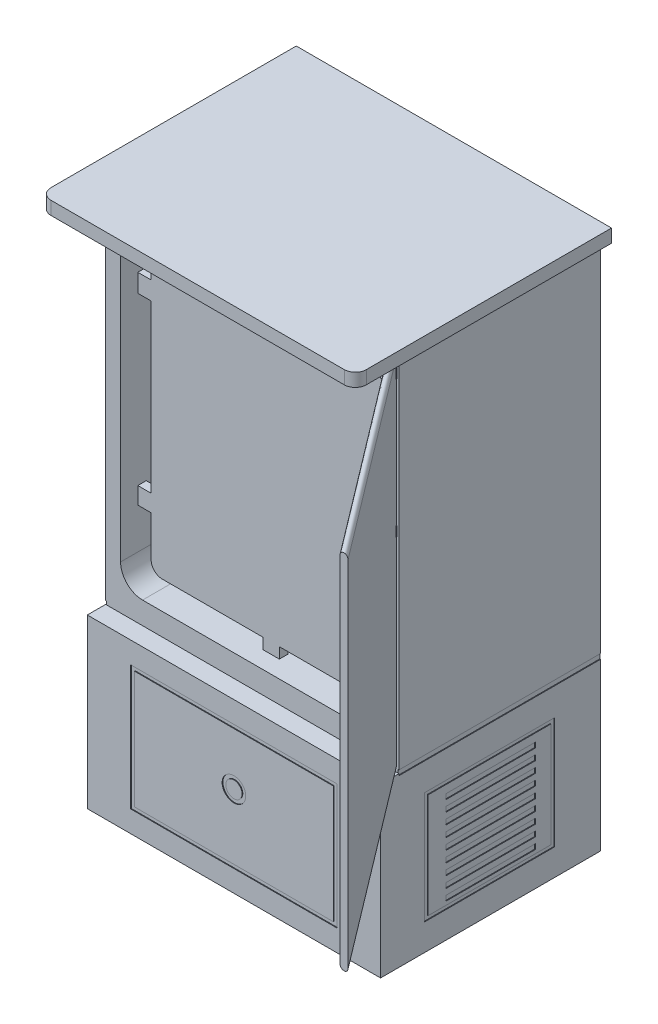
from build123d import *

# Parameters (mm, degrees)
CROQUIS1_W                = 800
CROQUIS1_H                = 600
SALIENTE_EXTRUIR1_DEPTH   = 1000
CORTAR_EXTRUIR1_DEPTH     = 567
CROQUIS3_W                = 800
CROQUIS3_H                = 35.957768847
SALIENTE_EXTRUIR2_DEPTH   = 99
CROQUIS4_W                = 699
CROQUIS4_H                = 35.957768847
SALIENTE_EXTRUIR3_DEPTH   = 30
CROQUIS5_W                = 699
CROQUIS5_H                = 35.957768847
SALIENTE_EXTRUIR4_DEPTH   = 30
REDONDEO1_R               = 30
CROQUIS6_W                = 800
CROQUIS6_H                = 486.805991466
SALIENTE_EXTRUIR5_DEPTH   = 600
CROQUIS8_W                = 800
CROQUIS8_H                = 993.182062535
CORTAR_EXTRUIR3_DEPTH     = 50
CROQUIS9_W                = 550
CROQUIS9_H                = 13.666207369
CORTAR_EXTRUIR4_DEPTH     = 2
CROQUIS10_W               = 550
CROQUIS10_H               = 13.666207369
CORTAR_EXTRUIR5_DEPTH     = 2
CROQUIS11_W               = 354.416964099
CROQUIS11_H               = 305.343845993
CROQUIS11_W_2             = 334.416964099
CROQUIS11_H_2             = 285.343845993
CORTAR_EXTRUIR6_DEPTH     = 2
CROQUIS12_W               = 354.416964099
CROQUIS12_H               = 305.343845993
CROQUIS12_W_2             = 334.416964099
CROQUIS12_H_2             = 285.343845993
CORTAR_EXTRUIR7_DEPTH     = 2
CROQUIS13_W               = 243.309624206
CROQUIS13_H               = 13.939613887
CORTAR_EXTRUIR8_DEPTH     = 2
MATRIZL1_COUNT            = 9
MATRIZL1_PITCH            = 30
SIMETR_A1_COPY_1_SKETCH_W = 243.309624206
SIMETR_A1_COPY_1_SKETCH_H = 13.939613887
SIMETR_A1_COPY_1_DEPTH    = 2
SIMETR_A1_COPY_2_SKETCH_W = 243.309624206
SIMETR_A1_COPY_2_SKETCH_H = 13.939613887
SIMETR_A1_COPY_2_DEPTH    = 2
SIMETR_A1_COPY_3_SKETCH_W = 243.309624206
SIMETR_A1_COPY_3_SKETCH_H = 13.939613887
SIMETR_A1_COPY_3_DEPTH    = 2
SIMETR_A1_COPY_4_SKETCH_W = 243.309624206
SIMETR_A1_COPY_4_SKETCH_H = 13.939613887
SIMETR_A1_COPY_4_DEPTH    = 2
SIMETR_A1_COPY_5_SKETCH_W = 243.309624206
SIMETR_A1_COPY_5_SKETCH_H = 13.939613887
SIMETR_A1_COPY_5_DEPTH    = 2
SIMETR_A1_COPY_6_SKETCH_W = 243.309624206
SIMETR_A1_COPY_6_SKETCH_H = 13.939613887
SIMETR_A1_COPY_6_DEPTH    = 2
SIMETR_A1_COPY_7_SKETCH_W = 243.309624206
SIMETR_A1_COPY_7_SKETCH_H = 13.939613887
SIMETR_A1_COPY_7_DEPTH    = 2
SIMETR_A1_COPY_8_SKETCH_W = 243.309624206
SIMETR_A1_COPY_8_SKETCH_H = 13.939613887
SIMETR_A1_COPY_8_DEPTH    = 2
CROQUIS14_W               = 563.20495413
CROQUIS14_H               = 340.598481742
CROQUIS14_W_2             = 543.20495413
CROQUIS14_H_2             = 320.598481742
CORTAR_EXTRUIR9_DEPTH     = 2
CROQUIS15_R               = 32.209771252
CROQUIS15_R_2             = 22.209771252
CORTAR_EXTRUIR10_DEPTH    = 2
CROQUIS18_W               = 34.691743086
CROQUIS18_H               = 30.529625404
CROQUIS18_W_2             = 44.468602639
CROQUIS18_H_2             = 33.523883017
CROQUIS18_H_3             = 26.695345902
SALIENTE_EXTRUIR6_DEPTH   = 22
REDONDEO2_R               = 19
CORTAR_EXTRUIR11_DEPTH    = 3
CROQUIS20_W               = 44.562430694
CROQUIS20_H               = 46.694432352
CROQUIS20_H_2             = 35.984257535
CROQUIS20_W_2             = 73.041407783
CROQUIS20_H_3             = 49.656905024
CROQUIS20_H_4             = 46.208188546
CROQUIS20_W_3             = 57.507633586
CROQUIS20_H_5             = 75.965991012
CROQUIS20_W_4             = 44.486501302
CROQUIS20_H_6             = 58.796125296
SALIENTE_EXTRUIR7_DEPTH   = 23
CROQUIS21_W               = 535.403782416
CROQUIS21_H               = 17.835231245
SALIENTE_EXTRUIR8_DEPTH   = 218


with BuildPart() as part:
    # Croquis1 → Saliente-Extruir1 (new body)
    with BuildSketch(Plane(origin=(0, 0, 0), x_dir=(1, 0, 0), z_dir=(0, 1, 0))):
        Rectangle(CROQUIS1_W, CROQUIS1_H)
    extrude(amount=SALIENTE_EXTRUIR1_DEPTH)

    # Croquis2 → Cortar-Extruir1 (cut)
    with BuildSketch(Plane.XY.offset(300)):
        with BuildLine():
            Line((-299.259727569, 934.483814363), (294.27207392, 934.483814363))
            ThreePointArc((294.27207392, 934.483814363), (336.698480791, 916.910221234), (354.27207392, 874.483814363))
            Line((354.27207392, 874.483814363), (354.27207392, 91.459739531))
            ThreePointArc((354.27207392, 91.459739531), (336.698480791, 49.03333266), (294.27207392, 31.459739531))
            Line((294.27207392, 31.459739531), (-299.259727569, 31.459739531))
            ThreePointArc((-299.259727569, 31.459739531), (-341.68613444, 49.03333266), (-359.259727569, 91.459739531))
            Line((-359.259727569, 91.459739531), (-359.259727569, 874.483814363))
            ThreePointArc((-359.259727569, 874.483814363), (-341.68613444, 916.910221234), (-299.259727569, 934.483814363))
        make_face()
    extrude(amount=-CORTAR_EXTRUIR1_DEPTH, mode=Mode.SUBTRACT)

    # Croquis3 → Saliente-Extruir2 (add)
    with BuildSketch(Plane.XY.offset(300)):
        with Locations((0, 982.021115577)):
            Rectangle(CROQUIS3_W, CROQUIS3_H)
    extrude(amount=SALIENTE_EXTRUIR2_DEPTH)

    # Croquis4 → Saliente-Extruir3 (add)
    with BuildSketch(Plane(origin=(400, 0, 0), x_dir=(0, 0, -1), z_dir=(1, 0, 0))):
        with Locations((-49.5, 982.021115577)):
            Rectangle(CROQUIS4_W, CROQUIS4_H)
    extrude(amount=SALIENTE_EXTRUIR3_DEPTH)

    # Croquis5 → Saliente-Extruir4 (add)
    with BuildSketch(Plane.ZY.offset(400)):
        with Locations((49.5, 982.021115577)):
            Rectangle(CROQUIS5_W, CROQUIS5_H)
    extrude(amount=SALIENTE_EXTRUIR4_DEPTH)

    # Redondeo1
    redondeo1_edges = [part.edges().sort_by_distance(p)[0] for p in [
        (430, 982.021115577, 399),
        (-430, 982.021115577, 399),
    ]]
    fillet(redondeo1_edges, radius=REDONDEO1_R)

    # Croquis6 → Saliente-Extruir5 (add)
    with BuildSketch(Plane(origin=(0, 0, -300), x_dir=(-1, 0, 0), z_dir=(0, 0, -1))):
        with Locations((0, -243.402995733)):
            Rectangle(CROQUIS6_W, CROQUIS6_H)
    extrude(amount=-SALIENTE_EXTRUIR5_DEPTH)

    # Croquis8 → Cortar-Extruir3 (cut)
    with BuildSketch(Plane.XY.offset(300)):
        with Locations((0, 467.451199886)):
            Rectangle(CROQUIS8_W, CROQUIS8_H)
    extrude(amount=-CORTAR_EXTRUIR3_DEPTH, mode=Mode.SUBTRACT)

    # Croquis9 → Cortar-Extruir4 (cut)
    with BuildSketch(Plane.ZY.offset(400)):
        with Locations((-25, -27.151049572)):
            Rectangle(CROQUIS9_W, CROQUIS9_H)
    extrude(amount=-CORTAR_EXTRUIR4_DEPTH, mode=Mode.SUBTRACT)

    # Croquis10 → Cortar-Extruir5 (cut)
    with BuildSketch(Plane(origin=(400, 0, 0), x_dir=(0, 0, -1), z_dir=(1, 0, 0))):
        with Locations((25, -27.151049572)):
            Rectangle(CROQUIS10_W, CROQUIS10_H)
    extrude(amount=-CORTAR_EXTRUIR5_DEPTH, mode=Mode.SUBTRACT)

    # Croquis11 → Cortar-Extruir6 (cut)
    with BuildSketch(Plane.ZY.offset(400)):
        with Locations((2.727596994, -261.728327175)):
            Rectangle(CROQUIS11_W, CROQUIS11_H)
        with Locations((2.727596994, -261.728327175)):
            Rectangle(CROQUIS11_W_2, CROQUIS11_H_2, mode=Mode.SUBTRACT)
    extrude(amount=-CORTAR_EXTRUIR6_DEPTH, mode=Mode.SUBTRACT)

    # Croquis12 → Cortar-Extruir7 (cut)
    with BuildSketch(Plane(origin=(400, 0, 0), x_dir=(0, 0, -1), z_dir=(1, 0, 0))):
        with Locations((-2.727596994, -261.728327175)):
            Rectangle(CROQUIS12_W, CROQUIS12_H)
        with Locations((-2.727596994, -261.728327175)):
            Rectangle(CROQUIS12_W_2, CROQUIS12_H_2, mode=Mode.SUBTRACT)
    extrude(amount=-CORTAR_EXTRUIR7_DEPTH, mode=Mode.SUBTRACT)

    # Croquis13 → Cortar-Extruir8 (cut)
    with BuildSketch(Plane.ZY.offset(400)):
        with Locations((-0.370526782, -147.593668647)):
            Rectangle(CROQUIS13_W, CROQUIS13_H)
    cortar_extruir8 = extrude(amount=-CORTAR_EXTRUIR8_DEPTH, mode=Mode.SUBTRACT)

    # MatrizL1: Cortar-Extruir8 ×9
    with Locations(*[(0, -i * MATRIZL1_PITCH, 0) for i in range(1, MATRIZL1_COUNT)]):
        add(cortar_extruir8, mode=Mode.SUBTRACT)

    # Simetría1: Cortar-Extruir8 across plane
    add(cortar_extruir8.mirror(Plane(origin=(0, 0, 0), x_dir=(0, 0, 1), z_dir=(1, 0, 0))), mode=Mode.SUBTRACT)

    # Simetría1 copy 1 sketch → Simetría1 copy 1 (cut)
    with BuildSketch(Plane(origin=(400, -30, 0), x_dir=(0, 0, 1), z_dir=(1, 0, 0))):
        with Locations((-0.370526782, 147.593668647)):
            Rectangle(SIMETR_A1_COPY_1_SKETCH_W, SIMETR_A1_COPY_1_SKETCH_H)
    extrude(amount=-SIMETR_A1_COPY_1_DEPTH, mode=Mode.SUBTRACT)

    # Simetría1 copy 2 sketch → Simetría1 copy 2 (cut)
    with BuildSketch(Plane(origin=(400, -60, 0), x_dir=(0, 0, 1), z_dir=(1, 0, 0))):
        with Locations((-0.370526782, 147.593668647)):
            Rectangle(SIMETR_A1_COPY_2_SKETCH_W, SIMETR_A1_COPY_2_SKETCH_H)
    extrude(amount=-SIMETR_A1_COPY_2_DEPTH, mode=Mode.SUBTRACT)

    # Simetría1 copy 3 sketch → Simetría1 copy 3 (cut)
    with BuildSketch(Plane(origin=(400, -90, 0), x_dir=(0, 0, 1), z_dir=(1, 0, 0))):
        with Locations((-0.370526782, 147.593668647)):
            Rectangle(SIMETR_A1_COPY_3_SKETCH_W, SIMETR_A1_COPY_3_SKETCH_H)
    extrude(amount=-SIMETR_A1_COPY_3_DEPTH, mode=Mode.SUBTRACT)

    # Simetría1 copy 4 sketch → Simetría1 copy 4 (cut)
    with BuildSketch(Plane(origin=(400, -120, 0), x_dir=(0, 0, 1), z_dir=(1, 0, 0))):
        with Locations((-0.370526782, 147.593668647)):
            Rectangle(SIMETR_A1_COPY_4_SKETCH_W, SIMETR_A1_COPY_4_SKETCH_H)
    extrude(amount=-SIMETR_A1_COPY_4_DEPTH, mode=Mode.SUBTRACT)

    # Simetría1 copy 5 sketch → Simetría1 copy 5 (cut)
    with BuildSketch(Plane(origin=(400, -150, 0), x_dir=(0, 0, 1), z_dir=(1, 0, 0))):
        with Locations((-0.370526782, 147.593668647)):
            Rectangle(SIMETR_A1_COPY_5_SKETCH_W, SIMETR_A1_COPY_5_SKETCH_H)
    extrude(amount=-SIMETR_A1_COPY_5_DEPTH, mode=Mode.SUBTRACT)

    # Simetría1 copy 6 sketch → Simetría1 copy 6 (cut)
    with BuildSketch(Plane(origin=(400, -180, 0), x_dir=(0, 0, 1), z_dir=(1, 0, 0))):
        with Locations((-0.370526782, 147.593668647)):
            Rectangle(SIMETR_A1_COPY_6_SKETCH_W, SIMETR_A1_COPY_6_SKETCH_H)
    extrude(amount=-SIMETR_A1_COPY_6_DEPTH, mode=Mode.SUBTRACT)

    # Simetría1 copy 7 sketch → Simetría1 copy 7 (cut)
    with BuildSketch(Plane(origin=(400, -210, 0), x_dir=(0, 0, 1), z_dir=(1, 0, 0))):
        with Locations((-0.370526782, 147.593668647)):
            Rectangle(SIMETR_A1_COPY_7_SKETCH_W, SIMETR_A1_COPY_7_SKETCH_H)
    extrude(amount=-SIMETR_A1_COPY_7_DEPTH, mode=Mode.SUBTRACT)

    # Simetría1 copy 8 sketch → Simetría1 copy 8 (cut)
    with BuildSketch(Plane(origin=(400, -240, 0), x_dir=(0, 0, 1), z_dir=(1, 0, 0))):
        with Locations((-0.370526782, 147.593668647)):
            Rectangle(SIMETR_A1_COPY_8_SKETCH_W, SIMETR_A1_COPY_8_SKETCH_H)
    extrude(amount=-SIMETR_A1_COPY_8_DEPTH, mode=Mode.SUBTRACT)

    # Croquis14 → Cortar-Extruir9 (cut)
    with BuildSketch(Plane.XY.offset(300)):
        with Locations((0, -257.972911424)):
            Rectangle(CROQUIS14_W, CROQUIS14_H)
        with Locations((0, -257.972911424)):
            Rectangle(CROQUIS14_W_2, CROQUIS14_H_2, mode=Mode.SUBTRACT)
    extrude(amount=-CORTAR_EXTRUIR9_DEPTH, mode=Mode.SUBTRACT)

    # Croquis15 → Cortar-Extruir10 (cut)
    with BuildSketch(Plane.XY.offset(300)):
        with Locations((0, -241.078346398)):
            Circle(CROQUIS15_R)
        with Locations((0, -241.078346398)):
            Circle(CROQUIS15_R_2, mode=Mode.SUBTRACT)
    extrude(amount=-CORTAR_EXTRUIR10_DEPTH, mode=Mode.SUBTRACT)

    # Barrer1: sweep along a curve in space
    with BuildLine() as barrer1_path:
        Line((381.946438311, 467.235507916, 250), (793.481110183, 467.318527679, 793.146863733))
    # Croquis17 → Barrer1 (sweep)
    with BuildSketch(Plane.XY.offset(250)):
        with BuildLine():
            Line((392.862198364, 950.092677746), (392.862198364, -15.621661914))
            ThreePointArc((392.862198364, -15.621661914), (381.946438311, -26.537421967), (371.030678258, -15.621661914))
            Line((371.030678258, -15.621661914), (371.030678258, 950.092677746))
            ThreePointArc((371.030678258, 950.092677746), (381.946438311, 961.0084378), (392.862198364, 950.092677746))
        make_face()
    sweep(path=barrer1_path.line)

    # Croquis18 → Saliente-Extruir6 (add)
    with BuildSketch(Plane.XY.offset(250)):
        with Locations((377.357040996, 915.688026457)):
            Rectangle(CROQUIS18_W, CROQUIS18_H)
        with Locations((368.316814459, 6.739425021)):
            Rectangle(CROQUIS18_W_2, CROQUIS18_H_2)
        with Locations((377.357040996, 540.796431256)):
            Rectangle(CROQUIS18_W, CROQUIS18_H_3)
    extrude(amount=SALIENTE_EXTRUIR6_DEPTH)

    # Redondeo2
    redondeo2_edges = [part.edges().sort_by_distance(p)[0] for p in [
        (360.011169453, 915.688026457, 272),
        (346.082513139, 6.739425021, 272),
        (360.011169453, 540.796431256, 272),
    ]]
    fillet(redondeo2_edges, radius=REDONDEO2_R)

    # Croquis19 → Cortar-Extruir11 (cut)
    with BuildSketch(Plane(origin=(115.374267512, 0, -87.417445434), x_dir=(0.603913418650581, 0, 0.7970499248941487), z_dir=(-0.7970499248941487, 0, 0.603913418650581))):
        with BuildLine():
            Line((515.246456877, 6.925848235), (1050.984048336, 6.925848235))
            ThreePointArc((1050.984048336, 6.925848235), (1072.197251772, 15.712644799), (1080.984048336, 36.925848235))
            Line((1080.984048336, 36.925848235), (1080.984048336, 894.163276302))
            ThreePointArc((1080.984048336, 894.163276302), (1072.197251772, 915.376479738), (1050.984048336, 924.163276302))
            Line((1050.984048336, 924.163276302), (515.246456877, 924.163276302))
            ThreePointArc((515.246456877, 924.163276302), (494.033253441, 915.376479738), (485.246456877, 894.163276302))
            Line((485.246456877, 894.163276302), (485.246456877, 36.925848235))
            ThreePointArc((485.246456877, 36.925848235), (494.033253441, 15.712644799), (515.246456877, 6.925848235))
        make_face()
        with BuildLine():
            Line((495.246456877, 46.925848235), (495.246456877, 884.163276302))
            ThreePointArc((495.246456877, 884.163276302), (504.033253441, 905.376479738), (525.246456877, 914.163276302))
            Line((525.246456877, 914.163276302), (1040.984048336, 914.163276302))
            ThreePointArc((1040.984048336, 914.163276302), (1062.197251772, 905.376479738), (1070.984048336, 884.163276302))
            Line((1070.984048336, 884.163276302), (1070.984048336, 46.925848235))
            ThreePointArc((1070.984048336, 46.925848235), (1062.197251772, 25.712644799), (1040.984048336, 16.925848235))
            Line((1040.984048336, 16.925848235), (525.246456877, 16.925848235))
            ThreePointArc((525.246456877, 16.925848235), (504.033253441, 25.712644799), (495.246456877, 46.925848235))
        make_face(mode=Mode.SUBTRACT)
    extrude(amount=-CORTAR_EXTRUIR11_DEPTH, mode=Mode.SUBTRACT)

    # Croquis20 → Saliente-Extruir7 (add)
    with BuildSketch(Plane.XY.offset(180)):
        with BuildLine():
            Line((-292.739023677, 60.857802179), (301.990858573, 60.857802179))
            ThreePointArc((301.990858573, 60.857802179), (323.204062009, 69.644598744), (331.990858573, 90.857802179))
            Line((331.990858573, 90.857802179), (331.990858573, 866.500818857))
            ThreePointArc((331.990858573, 866.500818857), (323.204062009, 887.714022293), (301.990858573, 896.500818857))
            Line((301.990858573, 896.500818857), (-292.739023677, 896.500818857))
            ThreePointArc((-292.739023677, 896.500818857), (-313.952227113, 887.714022293), (-322.739023677, 866.500818857))
            Line((-322.739023677, 866.500818857), (-322.739023677, 90.857802179))
            ThreePointArc((-322.739023677, 90.857802179), (-313.952227113, 69.644598744), (-292.739023677, 60.857802179))
        make_face()
        with Locations((331.990858573, 727.730285012)):
            Rectangle(CROQUIS20_W, CROQUIS20_H)
        with Locations((331.990858573, 205.021757931)):
            Rectangle(CROQUIS20_W, CROQUIS20_H_2)
        with Locations((-322.739023677, 727.484970932)):
            Rectangle(CROQUIS20_W_2, CROQUIS20_H_3)
        with Locations((-322.739023677, 225.379990245)):
            Rectangle(CROQUIS20_W_2, CROQUIS20_H_4)
        with Locations((4.625917448, 896.500818857)):
            Rectangle(CROQUIS20_W_3, CROQUIS20_H_5)
        with Locations((4.625917448, 60.857802179)):
            Rectangle(CROQUIS20_W_4, CROQUIS20_H_6)
    extrude(amount=SALIENTE_EXTRUIR7_DEPTH)

    # Croquis21 → Saliente-Extruir8 (add)
    with BuildSketch(Plane.XY.offset(-267)):
        with Locations((0, 354.065407038)):
            Rectangle(CROQUIS21_W, CROQUIS21_H)
    extrude(amount=SALIENTE_EXTRUIR8_DEPTH)


solid = part.part
